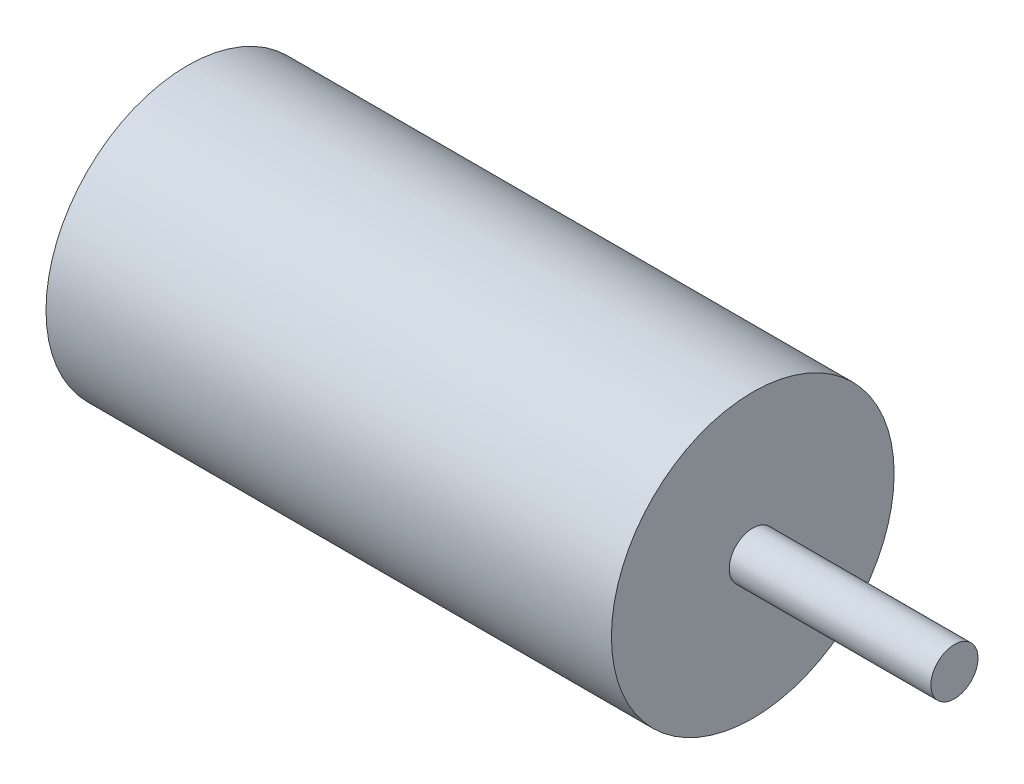
from build123d import *

# Parameters (mm, degrees)
SKETCH1_R           = 19.05
BOSS_EXTRUDE1_DEPTH = 76.2
SKETCH2_R           = 3.175
BOSS_EXTRUDE2_DEPTH = 27.178


with BuildPart() as part:
    # Sketch1 → Boss-Extrude1 (new body)
    with BuildSketch(Plane(origin=(0, 0, 0), x_dir=(0, 0, -1), z_dir=(1, 0, 0))):
        with Locations(Location((0, 0, 0), (0, 0, 180))):
            Circle(SKETCH1_R)
    extrude(amount=BOSS_EXTRUDE1_DEPTH)

    # Sketch2 → Boss-Extrude2 (add)
    with BuildSketch(Plane(origin=(76.2, 0, 0), x_dir=(0, 0, -1), z_dir=(1, 0, 0))):
        Circle(SKETCH2_R)
    extrude(amount=BOSS_EXTRUDE2_DEPTH)


solid = part.part
